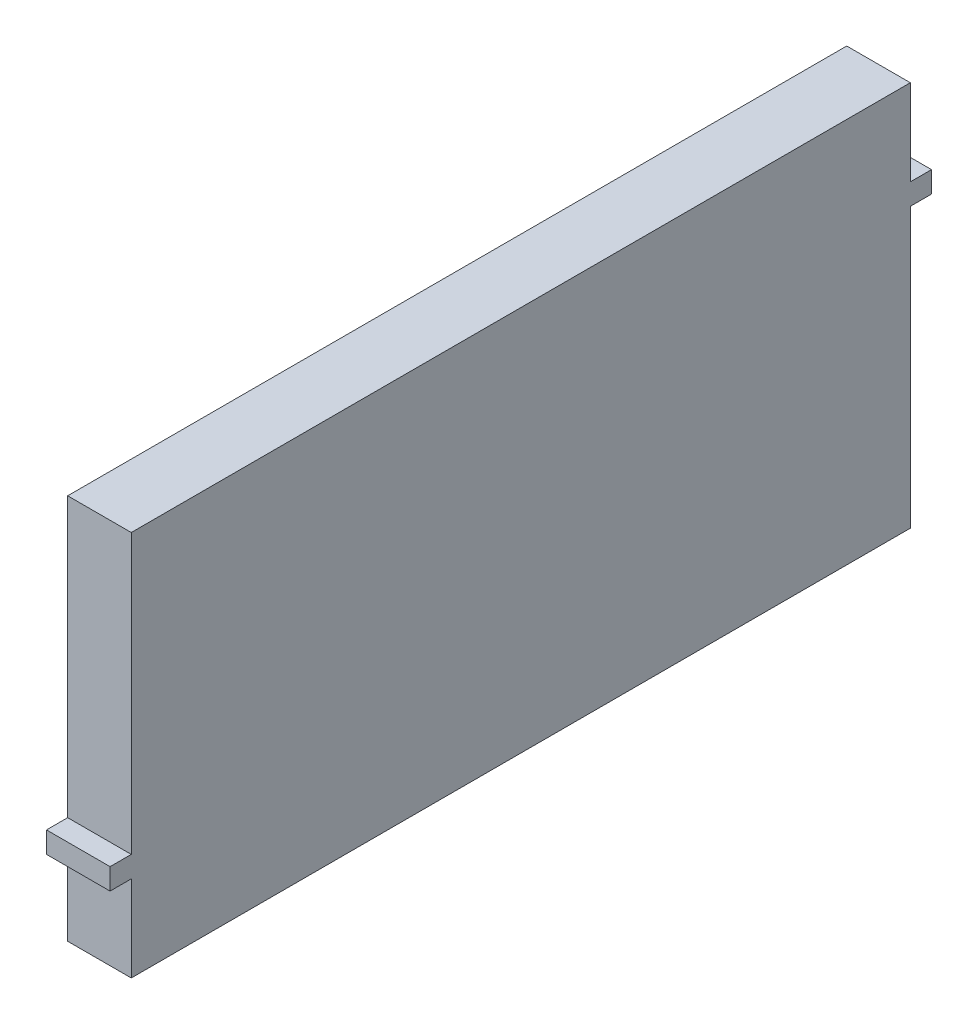
from build123d import *

# Parameters (mm, degrees)
BOSS_EXTRUDE1_DEPTH = 9.525


with BuildPart() as part:
    # Sketch1 → Boss-Extrude1 (new body)
    with BuildSketch(Plane(origin=(243.017706631, 0, 0), x_dir=(0, 0, -1), z_dir=(1, 0, 0))):
        Polygon((-679.249944078, 377.766708455), (-682.424944078, 377.766708455), (-682.424944078, 374.591708455), (-679.249944078, 374.591708455), (-679.249944078, 361.732958455), (-562.568694078, 361.732958455), (-562.568694078, 403.484208455), (-559.393694078, 403.484208455), (-559.393694078, 406.659208455), (-562.568694078, 406.659208455), (-562.568694078, 419.517958455), (-679.249944078, 419.517958455), align=None)
    extrude(amount=BOSS_EXTRUDE1_DEPTH)


solid = part.part
